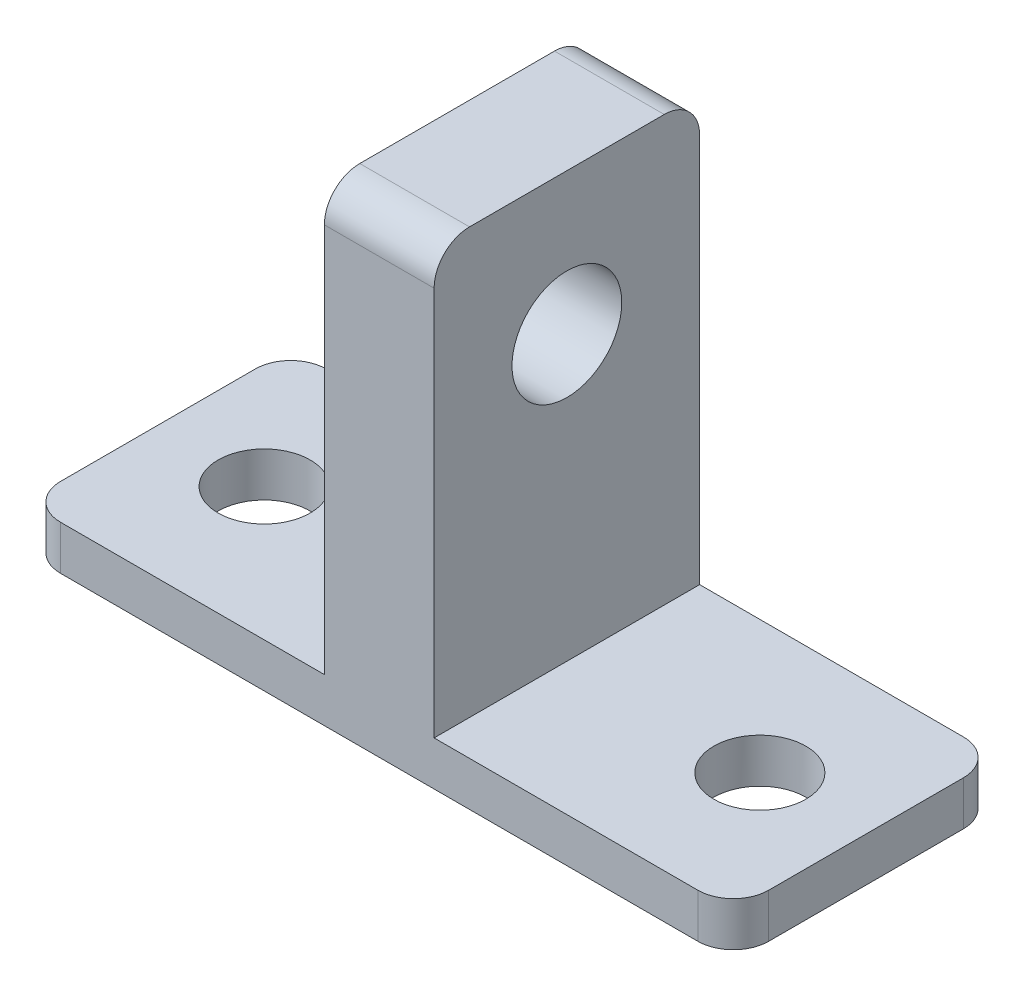
from build123d import *

# Parameters (mm, degrees)
SKETCH1_W               = 50.8
SKETCH1_H               = 19.05
BOSS_EXTRUDE1_DEPTH     = 3.175
SKETCH2_W               = 7.874
SKETCH2_H               = 19.05
BOSS_EXTRUDE2_DEPTH     = 30.48
CUT_EXTRUDE1_DEPTH      = 46.651333157
CUT_EXTRUDE1_DEPTH_BACK = 46.651333157
SKETCH3_R               = 3.937
CUT_EXTRUDE2_DEPTH      = 41.803382519
CUT_EXTRUDE2_DEPTH_BACK = 41.803382519
SKETCH5_R               = 3.302
FILLET2_R               = 2.54


with BuildPart() as part:
    # Sketch1 → Boss-Extrude1 (new body)
    with BuildSketch(Plane(origin=(0, 0, 0), x_dir=(1, 0, 0), z_dir=(0, 1, 0))):
        Rectangle(SKETCH1_W, SKETCH1_H)
    extrude(amount=BOSS_EXTRUDE1_DEPTH)

    # Sketch2 → Boss-Extrude2 (add)
    with BuildSketch(Plane(origin=(0, 3.175, 0), x_dir=(1, 0, 0), z_dir=(0, 1, 0))):
        Rectangle(SKETCH2_W, SKETCH2_H)
    extrude(amount=BOSS_EXTRUDE2_DEPTH)

    # Sketch3 → Cut-Extrude1 (cut, two sides: drawn at the far end of the back side and taken through both)
    with BuildSketch(Plane(origin=(3.937, 0, 0), x_dir=(0, 0, -1), z_dir=(1, 0, 0)).offset(-CUT_EXTRUDE1_DEPTH_BACK)):
        with Locations((0, 23.495)):
            Circle(SKETCH3_R)
    extrude(amount=CUT_EXTRUDE1_DEPTH + CUT_EXTRUDE1_DEPTH_BACK, mode=Mode.SUBTRACT)

    # Sketch5 → Cut-Extrude2 (cut, two sides: drawn at the far end of the back side and taken through both)
    with BuildSketch(Plane(origin=(0, 3.175, 0), x_dir=(1, 0, 0), z_dir=(0, 1, 0)).offset(-CUT_EXTRUDE2_DEPTH_BACK)):
        with Locations((-17.78, 0)):
            Circle(SKETCH5_R)
        with Locations((17.78, 0)):
            Circle(SKETCH5_R)
    extrude(amount=CUT_EXTRUDE2_DEPTH + CUT_EXTRUDE2_DEPTH_BACK, mode=Mode.SUBTRACT)

    # Fillet2
    fillet2_edges = [part.edges().sort_by_distance(p)[0] for p in [
        (-25.4, 1.5875, -9.525),
        (25.4, 1.5875, -9.525),
        (25.4, 1.5875, 9.525),
        (-25.4, 1.5875, 9.525),
        (0, 33.655, -9.525),
        (0, 33.655, 9.525),
    ]]
    fillet(fillet2_edges, radius=FILLET2_R)


solid = part.part
